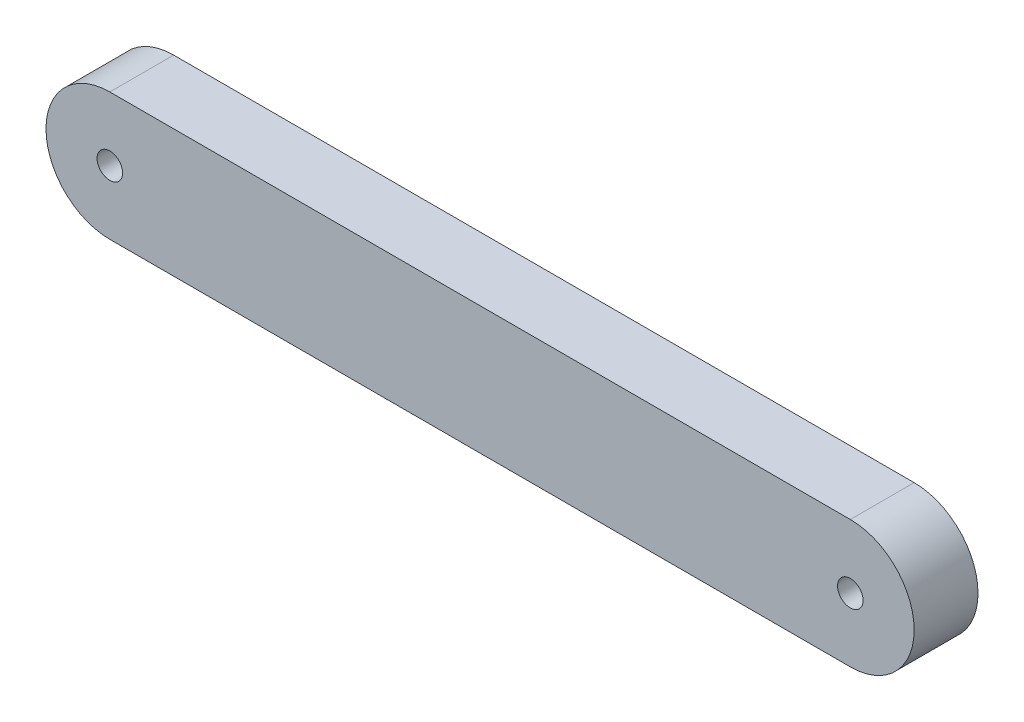
from build123d import *

# Parameters (mm, degrees)
SKETCH1_R           = 2
BOSS_EXTRUDE1_DEPTH = 10


with BuildPart() as part:
    # Sketch1 → Boss-Extrude1 (new body)
    with BuildSketch(Plane.XY):
        with BuildLine():
            Line((-77.232830821, -2.495812395), (-193.232830821, -2.495812395))
            ThreePointArc((-193.232830821, -2.495812395), (-203.232830821, 7.504187605), (-193.232830821, 17.504187605))
            Line((-193.232830821, 17.504187605), (-77.232830821, 17.504187605))
            ThreePointArc((-77.232830821, 17.504187605), (-67.232830821, 7.504187605), (-77.232830821, -2.495812395))
        make_face()
        with Locations((-193.232830821, 7.504187605)):
            Circle(SKETCH1_R, mode=Mode.SUBTRACT)
        with Locations((-77.232830821, 7.504187605)):
            Circle(SKETCH1_R, mode=Mode.SUBTRACT)
    extrude(amount=BOSS_EXTRUDE1_DEPTH)


solid = part.part
